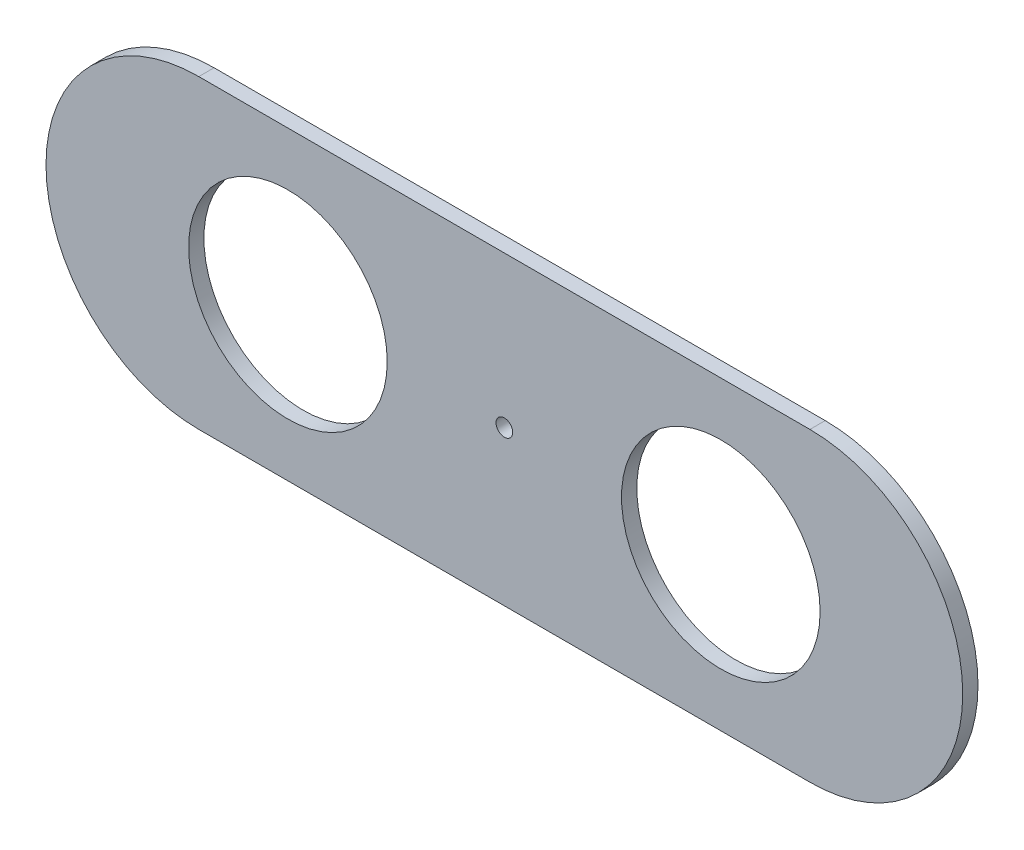
from build123d import *

# Parameters (mm, degrees)
BOSS_EXTRU_1_DEPTH      = 6
ENL_V_MAT_EXTRU_1_REACH = 191.832
ESQUISSE3_R             = 3.275
ENL_V_MAT_EXTRU_2_REACH = 191.832
ESQUISSE4_R             = 39


with BuildPart() as part:
    # Esquisse2 → Boss.-Extru.1 (new body)
    with BuildSketch(Plane.XY):
        with BuildLine():
            Line((120, -60), (-120, -60))
            ThreePointArc((-120, -60), (-180, 0), (-120, 60))
            Line((-120, 60), (120, 60))
            ThreePointArc((120, 60), (180, 0), (120, -60))
        make_face()
    extrude(amount=BOSS_EXTRU_1_DEPTH)

    # Esquisse3 → Enlèv. mat.-Extru.1 (cut, up to next)
    with BuildSketch(Plane.XY.offset(6), mode=Mode.PRIVATE) as enl_v_mat_extru_1_sk1:
        with Locations((0, 0.625)):
            Circle(ESQUISSE3_R)
    enl_v_mat_extru_1_tool1 = extrude(enl_v_mat_extru_1_sk1.sketch, amount=-ENL_V_MAT_EXTRU_1_REACH, mode=Mode.PRIVATE) & part.part
    add(enl_v_mat_extru_1_tool1.solids().sort_by_distance((0, 0.625, 6))[0], mode=Mode.SUBTRACT)

    # Esquisse4 → Enlèv. mat.-Extru.2 (cut, up to next)
    with BuildSketch(Plane.XY.offset(6), mode=Mode.PRIVATE) as enl_v_mat_extru_2_sk1:
        with Locations((-85, 0)):
            Circle(ESQUISSE4_R)
    enl_v_mat_extru_2_tool1 = extrude(enl_v_mat_extru_2_sk1.sketch, amount=-ENL_V_MAT_EXTRU_2_REACH, mode=Mode.PRIVATE) & part.part
    # Esquisse4 → Enlèv. mat.-Extru.2 (cut, up to next)
    with BuildSketch(Plane.XY.offset(6), mode=Mode.PRIVATE) as enl_v_mat_extru_2_sk2:
        with Locations((85, 0)):
            Circle(ESQUISSE4_R)
    enl_v_mat_extru_2_tool2 = extrude(enl_v_mat_extru_2_sk2.sketch, amount=-ENL_V_MAT_EXTRU_2_REACH, mode=Mode.PRIVATE) & part.part
    add(enl_v_mat_extru_2_tool1.solids().sort_by_distance((-85, 0, 6))[0], mode=Mode.SUBTRACT)
    add(enl_v_mat_extru_2_tool2.solids().sort_by_distance((85, 0, 6))[0], mode=Mode.SUBTRACT)


solid = part.part
